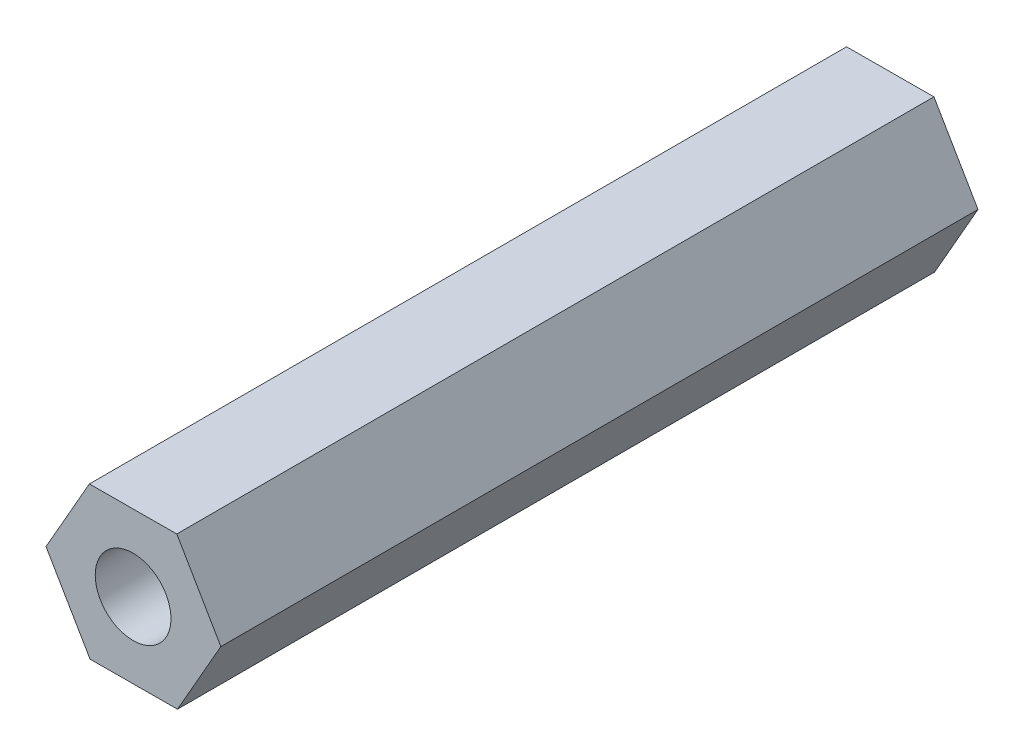
from build123d import *

# Parameters (mm, degrees)
EXTRUDE_1_DEPTH     = 25
SKETCH_2_R          = 1.25
CUT_EXTRUDE_1_DEPTH = 25


with BuildPart() as part:
    # 草图1 → 凸台-拉伸1 (new body)
    with BuildSketch(Plane.XY):
        Polygon((-66.857368384, 15.168882337), (-65.425196312, 17.675317354), (-66.879746674, 20.168832258), (-69.766469106, 20.155912147), (-71.198641178, 17.649477131), (-69.744090817, 15.155962226), align=None)
    extrude(amount=EXTRUDE_1_DEPTH)

    # 草图2 → 切除-拉伸1 (cut)
    with BuildSketch(Plane(origin=(0, 0, 0), x_dir=(-1, 0, 0), z_dir=(0, 0, -1))):
        with Locations((68.32310789, 17.649477131)):
            Circle(SKETCH_2_R)
    extrude(amount=-CUT_EXTRUDE_1_DEPTH, mode=Mode.SUBTRACT)


solid = part.part
